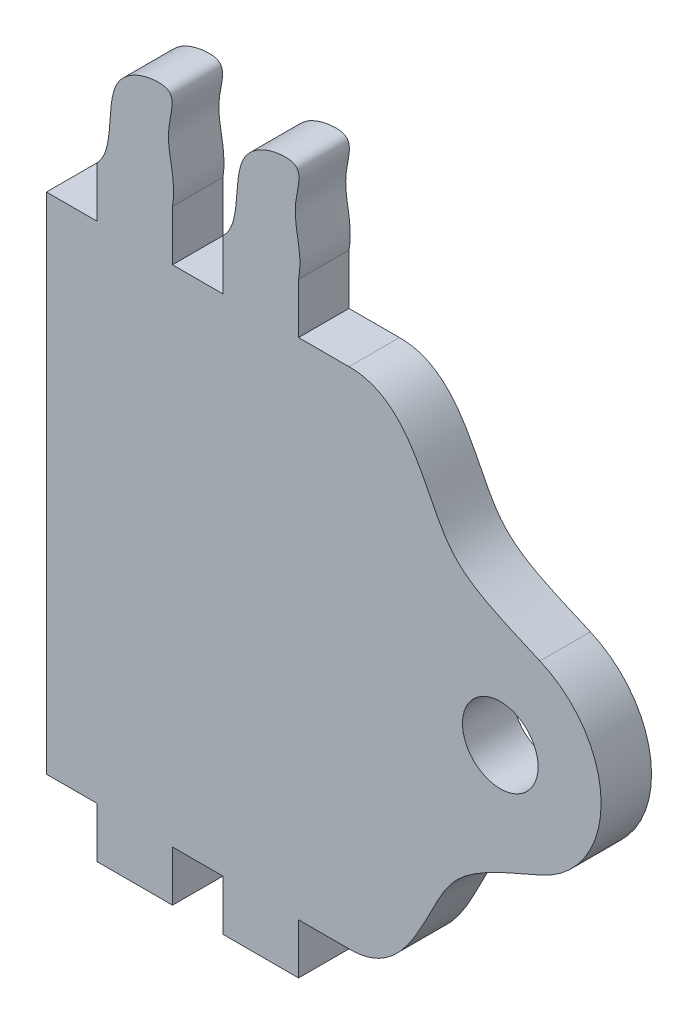
from build123d import *

# Parameters (mm, degrees)
SKETCH1_W           = 4.7625
SKETCH1_H           = 3.175
SKETCH1_R           = 2.38125
BOSS_EXTRUDE1_DEPTH = 3.175


with BuildPart() as part:
    # Sketch1 → Boss-Extrude1 (new body)
    # profile 1 of 9: a face of its own
    with BuildSketch(Plane.XY):
        Polygon((6.35, -15.875), (9.525, -15.875), (9.525, 15.875), (6.35, 15.875), (1.5875, 15.875), (-1.5875, 15.875), (-6.35, 15.875), (-9.525, 15.875), (-9.525, -15.875), (-6.35, -15.875), (-1.5875, -15.875), (1.5875, -15.875), align=None)
    # profile 2 of 9: a face of its own
    with BuildSketch(Plane.XY):
        with BuildLine():
            Line((9.525, 15.875), (9.525, -15.875))
            add(Edge.make_bspline(
                [(21.547594304, -5.838195157), (17.741398311, -7.466495201), (15.030939304, -8.836500628), (13.009281216, -15.917091584), (9.525, -15.875)],
                knots=[0, 0, 0, 0, 0.458191309, 1, 1, 1, 1], degree=3))
            ThreePointArc((21.547594304, -5.838195157), (12.7, 0), (21.547594304, 5.838195157))
            add(Edge.make_bspline(
                [(21.547594304, 5.838195157), (17.741398311, 7.466495201), (15.030939304, 8.836500628), (13.009281216, 15.917091584), (9.525, 15.875)],
                knots=[0, 0, 0, 0, 0.458191309, 1, 1, 1, 1], degree=3))
        make_face()
    # profile 3 of 9: a face of its own
    with BuildSketch(Plane.XY):
        with Locations((3.96875, -17.4625)):
            Rectangle(SKETCH1_W, SKETCH1_H)
    # profile 4 of 9: a face of its own
    with BuildSketch(Plane.XY):
        with BuildLine():
            ThreePointArc((21.547594304, 5.838195157), (12.7, 0), (21.547594304, -5.838195157))
            ThreePointArc((21.547594304, -5.838195157), (24.350104896, -3.497340144), (25.4, 0))
            ThreePointArc((25.4, 0), (24.350104896, 3.497340144), (21.547594304, 5.838195157))
        make_face()
        with Locations((19.05, 0)):
            Circle(SKETCH1_R, mode=Mode.SUBTRACT)
    # profile 5 of 9: a face of its own
    with BuildSketch(Plane.XY):
        with Locations((3.96875, 17.4625)):
            Rectangle(SKETCH1_W, SKETCH1_H)
    # profile 6 of 9: a face of its own
    with BuildSketch(Plane.XY):
        with Locations((-3.96875, -17.4625)):
            Rectangle(SKETCH1_W, SKETCH1_H)
    # profile 7 of 9: a face of its own
    with BuildSketch(Plane.XY):
        with BuildLine():
            Line((1.5875, 19.05), (6.35, 19.05))
            add(Edge.make_bspline(
                [(1.5875, 19.05), (2.876060697, 20.282977256), (1.750876168, 23.717010334), (4.480105354, 25.343943309), (6.713969799, 25.323271855), (5.664629716, 22.075566326), (6.66156491, 20.85876393), (6.35, 19.05)],
                knots=[0, 0, 0, 0, 0.347503902, 0.512635707, 0.589513021, 0.712232462, 1, 1, 1, 1], degree=3))
        make_face()
    # profile 8 of 9: a face of its own
    with BuildSketch(Plane.XY):
        with Locations((-3.96875, 17.4625)):
            Rectangle(SKETCH1_W, SKETCH1_H)
    # profile 9 of 9: a face of its own
    with BuildSketch(Plane.XY):
        with BuildLine():
            Line((-6.35, 19.05), (-1.5875, 19.05))
            add(Edge.make_bspline(
                [(-6.35, 19.05), (-5.108948033, 20.312838142), (-6.248797567, 23.782627537), (-3.504668245, 25.422749175), (-1.270595434, 25.401850486), (-2.33046195, 22.118193687), (-1.30296019, 20.902293296), (-1.5875, 19.05)],
                knots=[0, 0, 0, 0, 0.348300856, 0.511853831, 0.587996117, 0.709542233, 1, 1, 1, 1], degree=3))
        make_face()
    extrude(amount=BOSS_EXTRUDE1_DEPTH)


solid = part.part
